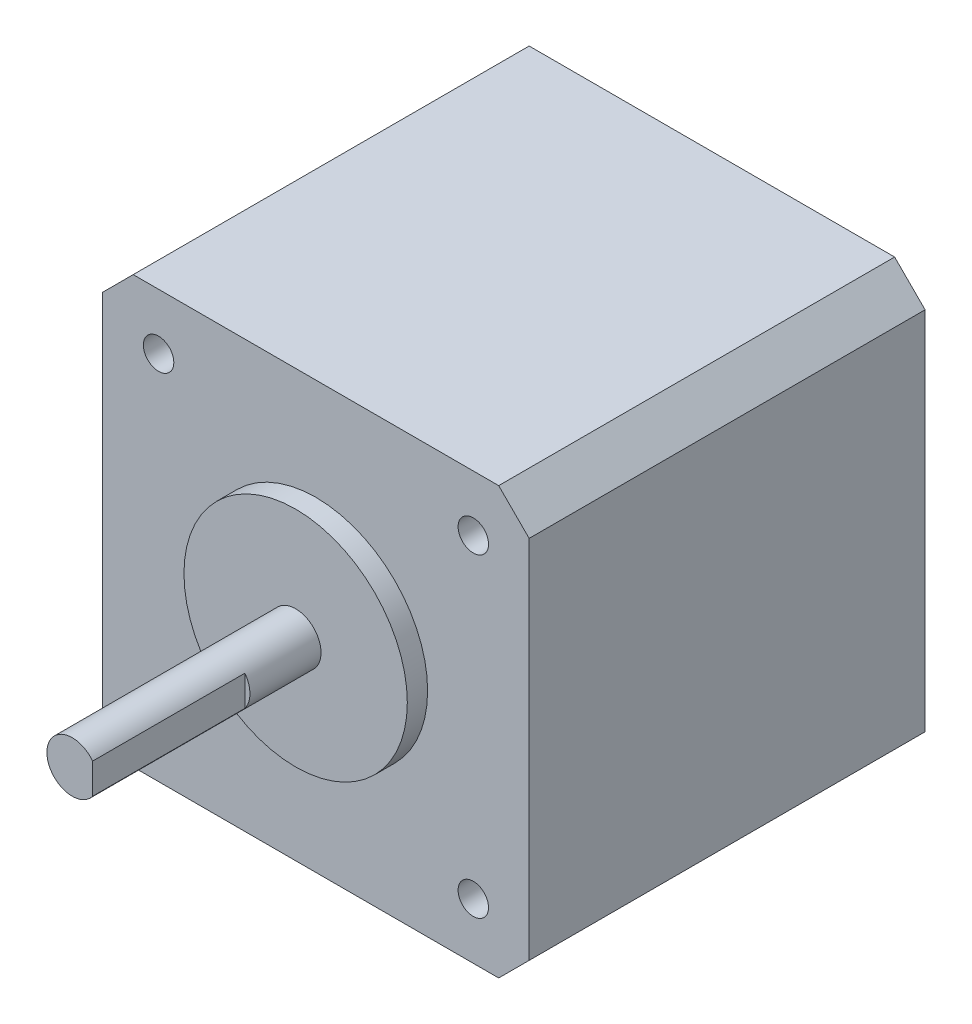
from build123d import *

# Parameters (mm, degrees)
SKETCH1_W               = 42
SKETCH1_H               = 42
BOSS_EXTRUDE1_DEPTH     = 39
SKETCH2_R               = 11
BOSS_EXTRUDE2_DEPTH     = 2
SKETCH3_R               = 2.5
BOSS_EXTRUDE3_DEPTH     = 22
CHAMFER1_SIZE           = 3
SKETCH4_R               = 1.5
CUT_EXTRUDE1_DEPTH      = 10
CUT_EXTRUDE2_DEPTH      = 87.585218138
CUT_EXTRUDE2_DEPTH_BACK = 15


with BuildPart() as part:
    # Sketch1 → Boss-Extrude1 (new body)
    with BuildSketch(Plane.XY):
        with Locations((21, 21)):
            Rectangle(SKETCH1_W, SKETCH1_H)
    extrude(amount=BOSS_EXTRUDE1_DEPTH)

    # Sketch2 → Boss-Extrude2 (add)
    with BuildSketch(Plane.XY.offset(39)):
        with Locations((21, 21)):
            Circle(SKETCH2_R)
    extrude(amount=BOSS_EXTRUDE2_DEPTH)

    # Sketch3 → Boss-Extrude3 (add)
    with BuildSketch(Plane.XY.offset(41)):
        with Locations((21, 21)):
            Circle(SKETCH3_R)
    extrude(amount=BOSS_EXTRUDE3_DEPTH)

    # Chamfer1
    chamfer1_edges = [part.edges().sort_by_distance(p)[0] for p in [
        (0, 42, 19.5),
        (42, 42, 19.5),
        (42, 0, 19.5),
        (0, 0, 19.5),
    ]]
    chamfer(chamfer1_edges, length=CHAMFER1_SIZE)

    # Sketch4 → Cut-Extrude1 (cut)
    with BuildSketch(Plane.XY.offset(39)):
        with Locations((5.5, 36.5)):
            Circle(SKETCH4_R)
        with Locations((5.5, 5.5)):
            Circle(SKETCH4_R)
        with Locations((36.5, 5.5)):
            Circle(SKETCH4_R)
        with Locations((36.5, 36.5)):
            Circle(SKETCH4_R)
    extrude(amount=-CUT_EXTRUDE1_DEPTH, mode=Mode.SUBTRACT)

    # Sketch5 → Cut-Extrude2 (cut, two sides: drawn at the far end of the back side and taken through both)
    with BuildSketch(Plane.XY.offset(63).offset(-CUT_EXTRUDE2_DEPTH_BACK)):
        Polygon((23, 96.850602173), (23, 22.5), (23, 19.5), (23, -54.850602173), (171.701204346, -54.850602173), (171.701204346, 96.850602173), align=None)
    extrude(amount=CUT_EXTRUDE2_DEPTH + CUT_EXTRUDE2_DEPTH_BACK, mode=Mode.SUBTRACT)


solid = part.part
